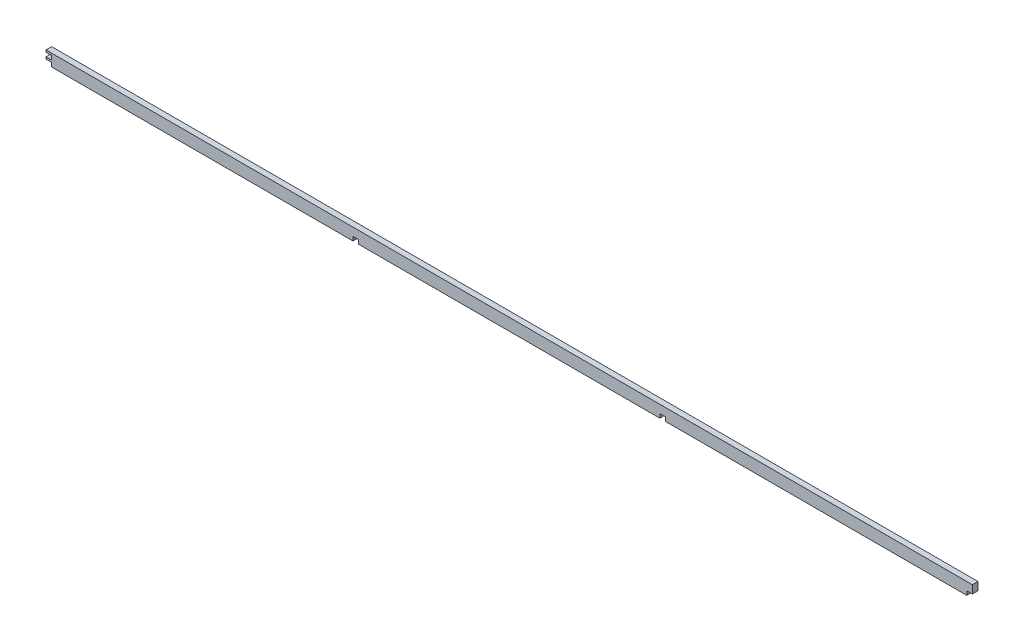
from build123d import *

# Parameters (mm, degrees)
EXTRUDE_1_DEPTH = 1.4


with BuildPart() as part:
    # Эскиз2 → Бобышка-Вытянуть1 (new, symmetric)
    with BuildSketch(Plane.XY):
        Polygon((-229.2, -3), (-79.2, -3), (-79.2, -1), (-76.4, -1), (-76.4, -3), (73.6, -3), (73.6, -1), (76.4, -1), (76.4, -3), (226.4, -3), (226.4, -1), (229.2, -1), (229.2, 3), (-229.2, 3), (-232, 3), (-232, 2), (-229.2, 2), (-229.2, 0), (-232, 0), (-232, -1), (-229.2, -1), align=None)
    extrude(amount=EXTRUDE_1_DEPTH, both=True)


solid = part.part
